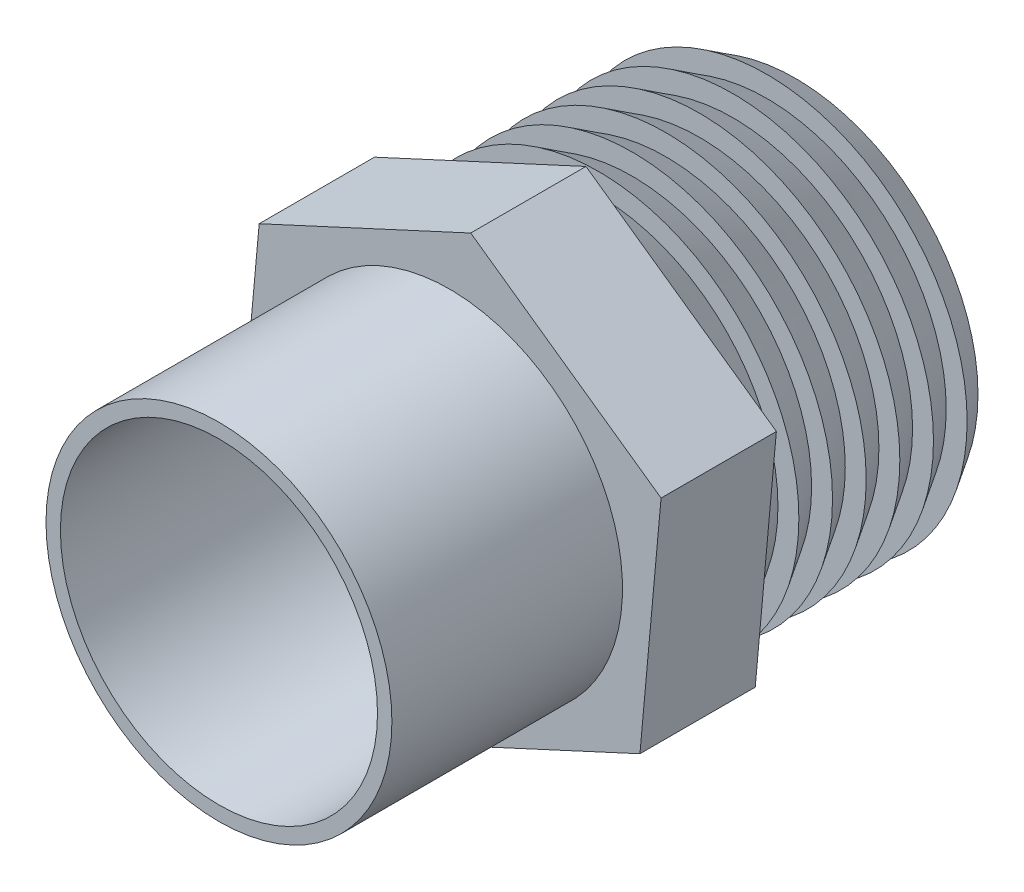
from build123d import *

# Parameters (mm, degrees)
SKETCH1_R           = 9.525
SKETCH1_R_2         = 8.73125
BOSS_EXTRUDE1_DEPTH = 12.7
BOSS_EXTRUDE2_DEPTH = 6.35
SKETCH4_R           = 8.73125
CUT_EXTRUDE1_DEPTH  = 37.153197474


with BuildPart() as part:
    # Sketch1 → Boss-Extrude1 (new body)
    with BuildSketch(Plane.XY):
        Circle(SKETCH1_R)
        Circle(SKETCH1_R_2, mode=Mode.SUBTRACT)
    extrude(amount=BOSS_EXTRUDE1_DEPTH)

    # Sketch2 → Boss-Extrude2 (add)
    with BuildSketch(Plane(origin=(0, 0, 0), x_dir=(-1, 0, 0), z_dir=(0, 0, -1))):
        Polygon((-10.484370366, -7.397850118), (1.164540953, -12.778656138), (11.648911318, -5.38080602), (10.484370366, 7.397850118), (-1.164540953, 12.778656138), (-11.648911318, 5.38080602), align=None)
    extrude(amount=BOSS_EXTRUDE2_DEPTH)

    # Sketch3 → Revolve1 (revolve)
    with BuildSketch(Plane(origin=(0, 0, 0), x_dir=(0, 0, -1), z_dir=(1, 0, 0)), mode=Mode.PRIVATE) as revolve1_sk:
        Polygon((6.35, 8.73125), (19.05, 8.73125), (19.05, 10.05294024), (17.470288197, 11.034529182), (17.470288197, 9.882889591), (15.616906831, 11.034529182), (15.616906831, 9.882889591), (13.763525465, 11.034529182), (13.763525465, 9.882889591), (11.910144098, 11.034529182), (11.910144098, 9.882889591), (10.056762732, 11.034529182), (10.056762732, 9.882889591), (8.203381366, 11.034529182), (8.203381366, 9.882889591), (6.35, 11.034529182), align=None)
    revolve(revolve1_sk.sketch.rotate(Axis((0, 0, 0), (0, 0, -1)), 90), axis=Axis((0, 0, 0), (0, 0, -1)))

    # Sketch4 → Cut-Extrude1 (cut, through all)
    with BuildSketch(Plane.XY.offset(12.7)):
        Circle(SKETCH4_R)
    extrude(amount=-CUT_EXTRUDE1_DEPTH, mode=Mode.SUBTRACT)


solid = part.part
